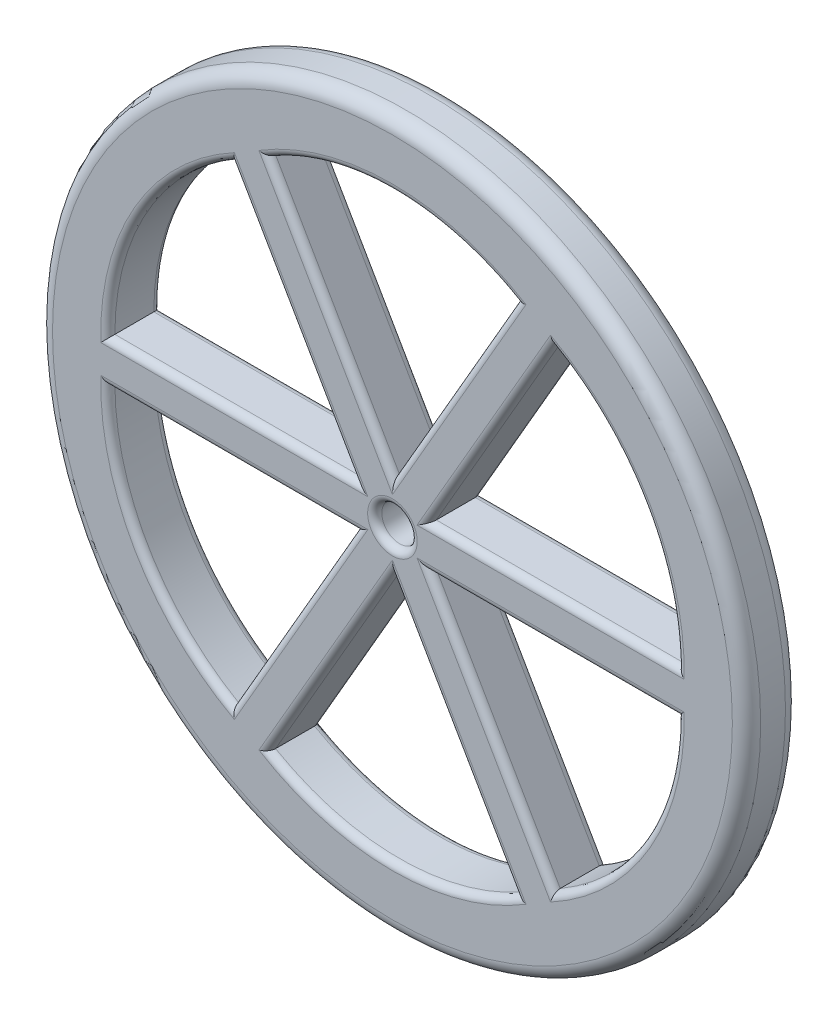
from build123d import *

# Parameters (mm, degrees)
SKETCH1_R           = 50
SKETCH1_R_2         = 2.5
BOSS_EXTRUDE1_DEPTH = 3.75
FILLET1_R           = 2
CUT_EXTRUDE1_DEPTH  = 72.107313267
CIRPATTERN1_COUNT   = 6
FILLET3_R           = 1
FILLET4_R           = 1


with BuildPart() as part:
    # Sketch1 → Boss-Extrude1 (new, symmetric)
    with BuildSketch(Plane.XY):
        Circle(SKETCH1_R)
        Circle(SKETCH1_R_2, mode=Mode.SUBTRACT)
    extrude(amount=BOSS_EXTRUDE1_DEPTH, both=True)

    # Fillet1
    fillet1_edges = [part.edges().sort_by_distance(p)[0] for p in [
        (-50, 0, -3.75),
        (-50, 0, 3.75),
    ]]
    fillet(fillet1_edges, radius=FILLET1_R)

    # Sketch2 → Cut-Extrude1 (cut, through all)
    with BuildSketch(Plane.XY.offset(3.75)):
        with BuildLine():
            Line((-17.5, 36.310889132), (0, 6))
            Line((0, 6), (17.5, 36.310889132))
            ThreePointArc((17.5, 36.310889132), (0, 41), (-17.5, 36.310889132))
        make_face()
    cut_extrude1 = extrude(amount=-CUT_EXTRUDE1_DEPTH, mode=Mode.SUBTRACT)

    # CirPattern1: Cut-Extrude1 ×6 about axis
    cirpattern1_axis = Axis((0, 0, 0), (0, 0, 1))
    for i in range(1, CIRPATTERN1_COUNT):
        add(cut_extrude1.rotate(cirpattern1_axis, i * 360 / CIRPATTERN1_COUNT), mode=Mode.SUBTRACT)

    # Fillet3
    fillet3_edges = [part.edges().sort_by_distance(p)[0] for p in [
        (8.75, 21.155444566, -3.75),
        (-8.75, 21.155444566, -3.75),
        (0, 41, -3.75),
        (-8.75, -21.155444566, -3.75),
        (8.75, -21.155444566, -3.75),
        (0, -41, -3.75),
        (-2.5, 0, -3.75),
        (-22.696152423, -3, -3.75),
        (-13.946152423, -18.155444566, -3.75),
        (-35.507041555, -20.5, -3.75),
        (13.946152423, -18.155444566, -3.75),
        (22.696152423, -3, -3.75),
        (35.507041555, -20.5, -3.75),
        (22.696152423, 3, -3.75),
        (13.946152423, 18.155444566, -3.75),
        (35.507041555, 20.5, -3.75),
        (-13.946152423, 18.155444566, -3.75),
        (-22.696152423, 3, -3.75),
        (-35.507041555, 20.5, -3.75),
    ]]
    fillet(fillet3_edges, radius=FILLET3_R)

    # Fillet4
    fillet4_edges = [part.edges().sort_by_distance(p)[0] for p in [
        (8.75, 21.155444566, 3.75),
        (0, 41, 3.75),
        (-8.75, 21.155444566, 3.75),
        (-8.75, -21.155444566, 3.75),
        (0, -41, 3.75),
        (8.75, -21.155444566, 3.75),
        (-22.696152423, -3, 3.75),
        (-35.507041555, -20.5, 3.75),
        (-13.946152423, -18.155444566, 3.75),
        (-2.5, 0, 3.75),
        (13.946152423, -18.155444566, 3.75),
        (35.507041555, -20.5, 3.75),
        (22.696152423, -3, 3.75),
        (22.696152423, 3, 3.75),
        (35.507041555, 20.5, 3.75),
        (13.946152423, 18.155444566, 3.75),
        (-13.946152423, 18.155444566, 3.75),
        (-35.507041555, 20.5, 3.75),
        (-22.696152423, 3, 3.75),
    ]]
    fillet(fillet4_edges, radius=FILLET4_R)


solid = part.part
